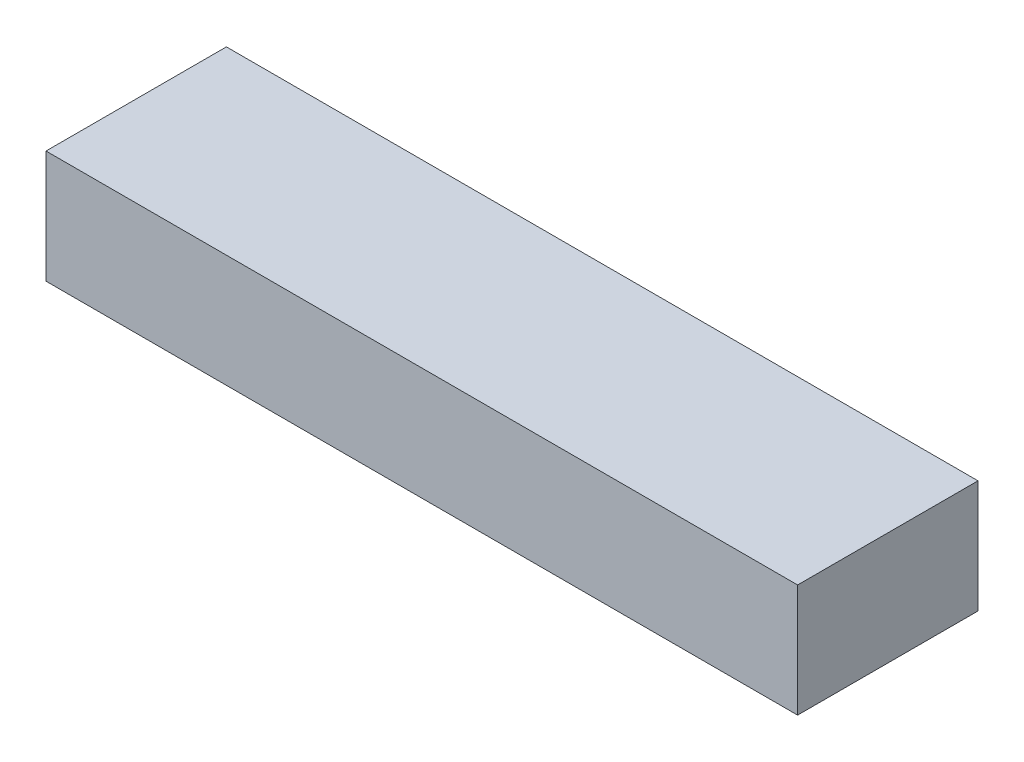
from build123d import *

# Parameters (mm, degrees)
SKETCH1_W           = 50
SKETCH1_H           = 12
BOSS_EXTRUDE1_DEPTH = 7.5


with BuildPart() as part:
    # Sketch1 → Boss-Extrude1 (new body)
    with BuildSketch(Plane(origin=(0, 0, 0), x_dir=(1, 0, 0), z_dir=(0, 1, 0))):
        Rectangle(SKETCH1_W, SKETCH1_H)
    extrude(amount=BOSS_EXTRUDE1_DEPTH)


solid = part.part
